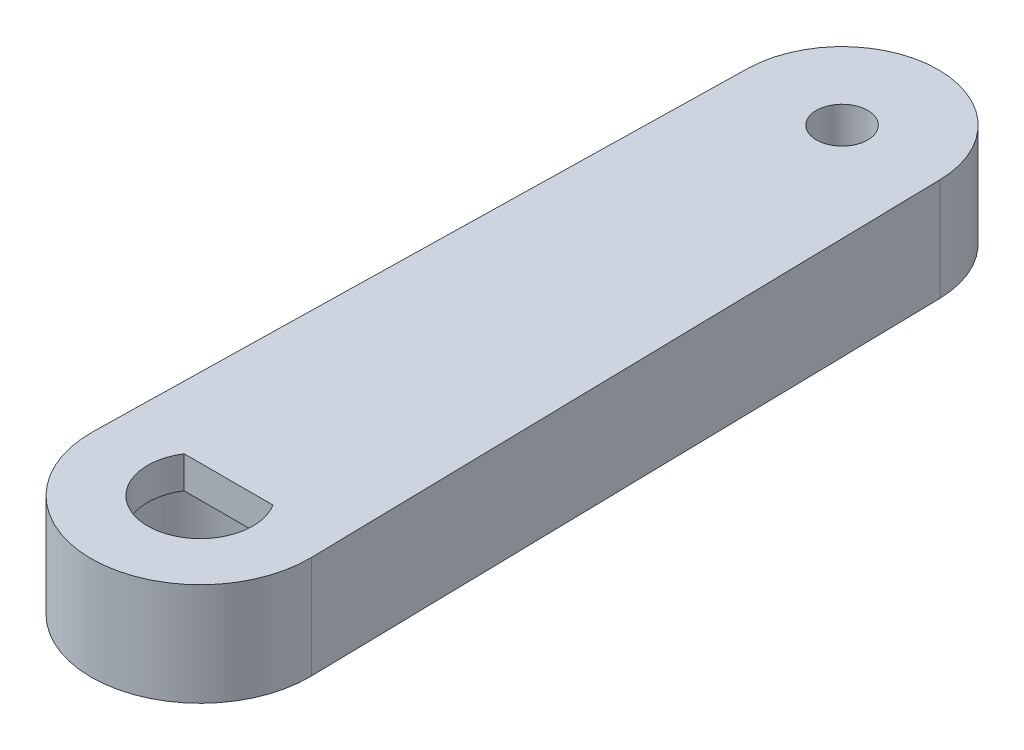
from build123d import *

# Parameters (mm, degrees)
SKETCH1_R           = 1
BOSS_EXTRUDE1_DEPTH = 4
CUT_EXTRUDE1_DEPTH  = 2.75
CUT_EXTRUDE4_DEPTH  = 10


with BuildPart() as part:
    # Sketch1 → Boss-Extrude1 (new body)
    with BuildSketch(Plane(origin=(0, 0, 0), x_dir=(1, 0, 0), z_dir=(0, 1, 0))):
        with BuildLine():
            Line((-3.749249925, 25.075), (-4.249149915, 0.085))
            ThreePointArc((-4.249149915, 0.085), (0, -4.25), (4.249149915, 0.085))
            Line((4.249149915, 0.085), (3.749249925, 25.075))
            ThreePointArc((3.749249925, 25.075), (0, 28.75), (-3.749249925, 25.075))
        make_face()
        with Locations((0, 25)):
            Circle(SKETCH1_R, mode=Mode.SUBTRACT)
    extrude(amount=BOSS_EXTRUDE1_DEPTH)

    # Sketch2 → Cut-Extrude1 (cut)
    with BuildSketch(Plane(origin=(0, 0, 0), x_dir=(1, 0, 0), z_dir=(0, 1, 0))):
        with BuildLine():
            ThreePointArc((2.15, 1.870828693), (-2.669269563, -0.998749218), (2.85, 0))
            ThreePointArc((2.85, 0), (2.669269563, 0.998749218), (2.15, 1.870828693))
        make_face()
        with BuildLine():
            ThreePointArc((2.15, 1.870828693), (2.669269563, 0.998749218), (2.85, 0))
            Line((2.85, 0), (2.85, 15))
            Line((2.85, 15), (2.15, 15))
            Line((2.15, 15), (2.15, 1.870828693))
        make_face()
    extrude(amount=CUT_EXTRUDE1_DEPTH, mode=Mode.SUBTRACT)

    # Sketch4 → Cut-Extrude4 (cut)
    with BuildSketch(Plane.XZ.offset(-2.75)):
        with BuildLine():
            Line((1.459053249, 1.440022089), (1.447376313, 1.451758179))
            ThreePointArc((1.447376313, 1.451758179), (-1.283674473, 1.598336587), (-1.729884389, -1.1))
            Line((-1.729884389, -1.1), (1.729884389, -1.1))
            ThreePointArc((1.729884389, -1.1), (2.038445209, 0.217350252), (1.459053249, 1.440022089))
        make_face()
    extrude(amount=-CUT_EXTRUDE4_DEPTH, mode=Mode.SUBTRACT)


solid = part.part
